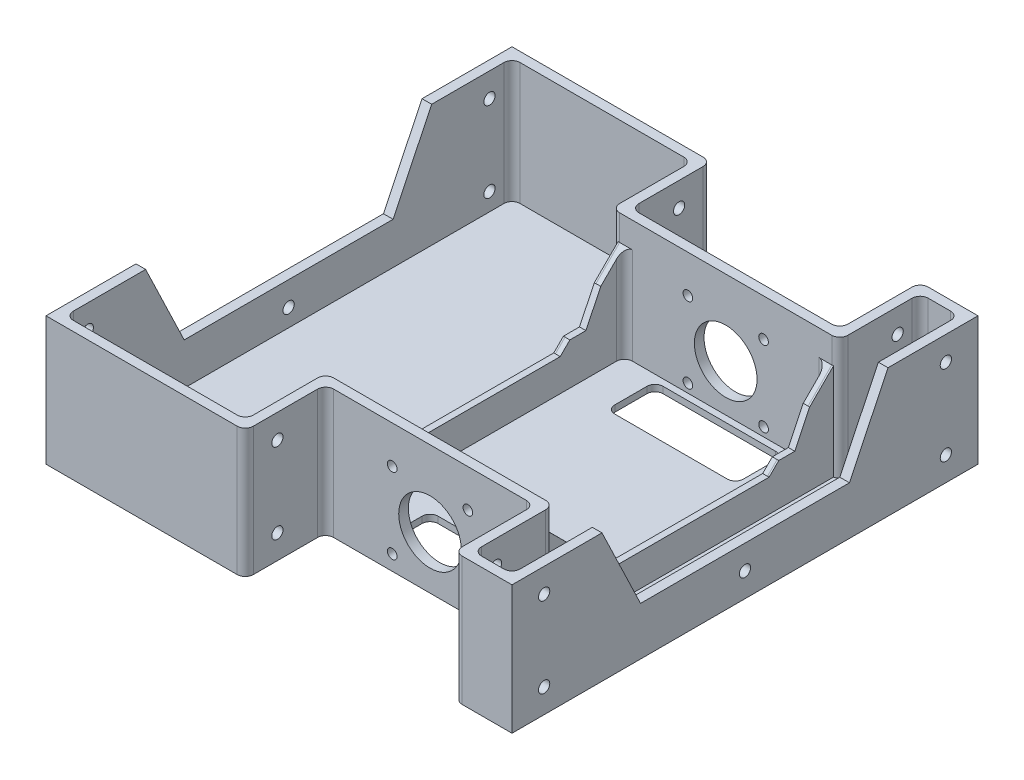
from build123d import *

# Parameters (mm, degrees)
SKETCH_1_W                = 290
SKETCH_1_H                = 290
EXTRUDE_1_DEPTH           = 4
EXTRUDE_2_DEPTH           = 76
SKETCH_16_W               = 130
SKETCH_16_H               = 50
CUT_EXTRUDE_11_DEPTH      = 10
SKETCH_4_W                = 6
SKETCH_4_H                = 290
EXTRUDE_3_DEPTH           = 76
SKETCH_7_R                = 2
CUT_EXTRUDE_3_DEPTH       = 10
SKETCH_14_W               = 80
SKETCH_14_H               = 30
CUT_EXTRUDE_9_DEPTH       = 20
CUT_EXTRUDE_10_DEPTH      = 334.95358959
CUT_EXTRUDE_10_DEPTH_BACK = 334.95358959
SKETCH_15_R               = 3.5
FILLET_1_R                = 5
CUT_EXTRUDE_12_DEPTH      = 292.590466236
CUT_EXTRUDE_12_DEPTH_BACK = 292.590466236
SKETCH_17_R               = 19.5
SKETCH_17_R_2             = 3
SKETCH_18_W               = 4
SKETCH_18_H               = 190
EXTRUDE_4_DEPTH           = 20
CHAMFER_1_SIZE            = 40
CUT_EXTRUDE_13_DEPTH      = 334.95358959
CUT_EXTRUDE_13_DEPTH_BACK = 334.95358959
FILLET_2_R                = 5


with BuildPart() as part:
    # Эскиз1 → Бобышка-Вытянуть1 (new body)
    with BuildSketch(Plane(origin=(0, 0, 0), x_dir=(1, 0, 0), z_dir=(0, 1, 0))):
        Rectangle(SKETCH_1_W, SKETCH_1_H)
    extrude(amount=EXTRUDE_1_DEPTH)

    # Эскиз2 → Бобышка-Вытянуть2 (add)
    with BuildSketch(Plane(origin=(0, 4, 0), x_dir=(1, 0, 0), z_dir=(0, 1, 0))):
        Polygon((145, 145), (109, 145), (109, 95), (-21, 95), (-21, 145), (-139, 145), (-139, 139), (-27, 139), (-27, 89), (115, 89), (115, 139), (139, 139), (139, -139), (115, -139), (115, -89), (-27, -89), (-27, -139), (-139, -139), (-139, -145), (-21, -145), (-21, -95), (109, -95), (109, -145), (145, -145), (145, 0.239524614), align=None)
    extrude(amount=EXTRUDE_2_DEPTH)

    # Эскиз16 → Вырез-Вытянуть11 (cut)
    with BuildSketch(Plane(origin=(0, 4, 0), x_dir=(1, 0, 0), z_dir=(0, 1, 0))):
        with Locations((44, 120)):
            Rectangle(SKETCH_16_W, SKETCH_16_H)
        with Locations((44, -120)):
            Rectangle(SKETCH_16_W, SKETCH_16_H)
    extrude(amount=-CUT_EXTRUDE_11_DEPTH, mode=Mode.SUBTRACT)

    # Эскиз4 → Бобышка-Вытянуть3 (add)
    with BuildSketch(Plane(origin=(0, 4, 0), x_dir=(1, 0, 0), z_dir=(0, 1, 0))):
        with Locations((-142, 0)):
            Rectangle(SKETCH_4_W, SKETCH_4_H)
    extrude(amount=EXTRUDE_3_DEPTH)

    # Эскиз7 → Вырез-Вытянуть3 (cut)
    with BuildSketch(Plane(origin=(0, 4, 0), x_dir=(1, 0, 0), z_dir=(0, 1, 0))):
        with Locations(Location((119, 82, 0), (0, 0, 270))):
            Circle(SKETCH_7_R)
        with Locations(Location((126, 75, 0), (0, 0, 270))):
            Circle(SKETCH_7_R)
        with Locations(Location((-31, 82, 0), (0, 0, 270))):
            Circle(SKETCH_7_R)
        with Locations(Location((-38, 75, 0), (0, 0, 270))):
            Circle(SKETCH_7_R)
        with Locations(Location((119, -82, 0), (0, 0, 270))):
            Circle(SKETCH_7_R)
        with Locations(Location((126, -75, 0), (0, 0, 270))):
            Circle(SKETCH_7_R)
        with Locations(Location((-38, -75, 0), (0, 0, 270))):
            Circle(SKETCH_7_R)
        with Locations(Location((-31, -82, 0), (0, 0, 270))):
            Circle(SKETCH_7_R)
    extrude(amount=-CUT_EXTRUDE_3_DEPTH, mode=Mode.SUBTRACT)

    # Эскиз14 → Вырез-Вытянуть9 (cut)
    with BuildSketch(Plane(origin=(0, 4, 0), x_dir=(1, 0, 0), z_dir=(0, 1, 0))):
        with Locations((44, 70)):
            Rectangle(SKETCH_14_W, SKETCH_14_H)
        with Locations((44, -70)):
            Rectangle(SKETCH_14_W, SKETCH_14_H)
    extrude(amount=-CUT_EXTRUDE_9_DEPTH, mode=Mode.SUBTRACT)

    # Эскиз15 → Вырез-Вытянуть10 (cut, two sides: drawn at the far end of the back side and taken through both)
    with BuildSketch(Plane.ZY.offset(145).offset(-CUT_EXTRUDE_10_DEPTH_BACK)):
        with Locations((0, 65)):
            Circle(SKETCH_15_R)
        with Locations((125, 65)):
            Circle(SKETCH_15_R)
        with Locations((-125, 65)):
            Circle(SKETCH_15_R)
        with Locations((-125, 15)):
            Circle(SKETCH_15_R)
        with Locations((125, 15)):
            Circle(SKETCH_15_R)
        with Locations((0, 15)):
            Circle(SKETCH_15_R)
    extrude(amount=CUT_EXTRUDE_10_DEPTH + CUT_EXTRUDE_10_DEPTH_BACK, mode=Mode.SUBTRACT)

    # Скругление1
    fillet_1_edges = [part.edges().sort_by_distance(p)[0] for p in [
        (109, 40, -145),
        (109, 40, -95),
        (-21, 40, -95),
        (-21, 40, -145),
        (-139, 42, -139),
        (-27, 42, -139),
        (-27, 42, -89),
        (115, 42, -89),
        (115, 42, -139),
        (139, 42, -139),
        (139, 42, 139),
        (115, 42, 139),
        (115, 42, 89),
        (-27, 42, 89),
        (-27, 42, 139),
        (-139, 42, 139),
        (-21, 40, 145),
        (-21, 40, 95),
        (109, 40, 95),
        (109, 40, 145),
    ]]
    fillet(fillet_1_edges, radius=FILLET_1_R)

    # Эскиз17 → Вырез-Вытянуть12 (cut, two sides: drawn at the far end of the back side and taken through both)
    with BuildSketch(Plane.XY.offset(95).offset(-CUT_EXTRUDE_12_DEPTH_BACK)):
        with Locations((44, 33)):
            Circle(SKETCH_17_R)
        with Locations((20.45, 56.55)):
            Circle(SKETCH_17_R_2)
        with Locations((67.55, 56.55)):
            Circle(SKETCH_17_R_2)
        with Locations((67.55, 9.45)):
            Circle(SKETCH_17_R_2)
        with Locations((20.45, 9.45)):
            Circle(SKETCH_17_R_2)
    extrude(amount=CUT_EXTRUDE_12_DEPTH + CUT_EXTRUDE_12_DEPTH_BACK, mode=Mode.SUBTRACT)

    # Эскиз18 → Бобышка-Вытянуть4 (add)
    with BuildSketch(Plane(origin=(0, 4, 0), x_dir=(1, 0, 0), z_dir=(0, 1, 0))):
        with Locations((-21, 0)):
            Rectangle(SKETCH_18_W, SKETCH_18_H)
        with Locations((109, 0)):
            Rectangle(SKETCH_18_W, SKETCH_18_H)
    extrude(amount=EXTRUDE_4_DEPTH)

    # Фаска1
    chamfer_1_edges = [part.edges().sort_by_distance(p)[0] for p in [
        (-22.50254481, 24, -89.025319235),
        (-20.5, 24, 89),
        (-20.5, 24, -89),
        (-22.50254481, 24, 89.025319235),
        (110.50254481, 24, -89.025319235),
        (110.50254481, 24, 89.025319235),
        (108.5, 24, 89),
        (108.5, 24, -89),
    ]]
    chamfer(chamfer_1_edges, length=CHAMFER_1_SIZE)

    # Эскиз19 → Вырез-Вытянуть13 (cut, two sides: drawn at the far end of the back side and taken through both)
    with BuildSketch(Plane(origin=(145, 0, 0), x_dir=(0, 0, -1), z_dir=(1, 0, 0)).offset(-CUT_EXTRUDE_13_DEPTH_BACK)):
        Polygon((-65, 30), (65, 30), (89, 80), (-89, 80), align=None)
    extrude(amount=CUT_EXTRUDE_13_DEPTH + CUT_EXTRUDE_13_DEPTH_BACK, mode=Mode.SUBTRACT)

    # Скругление2
    fillet_2_edges = [part.edges().sort_by_distance(p)[0] for p in [
        (84, 2, -85),
        (84, 2, -55),
        (4, 2, -55),
        (4, 2, -85),
        (4, 2, 85),
        (4, 2, 55),
        (84, 2, 55),
        (84, 2, 85),
        (-19, 34, 89),
        (-19, 34, -89),
        (107, 34, 89),
        (107, 34, -89),
    ]]
    fillet(fillet_2_edges, radius=FILLET_2_R)


solid = part.part
